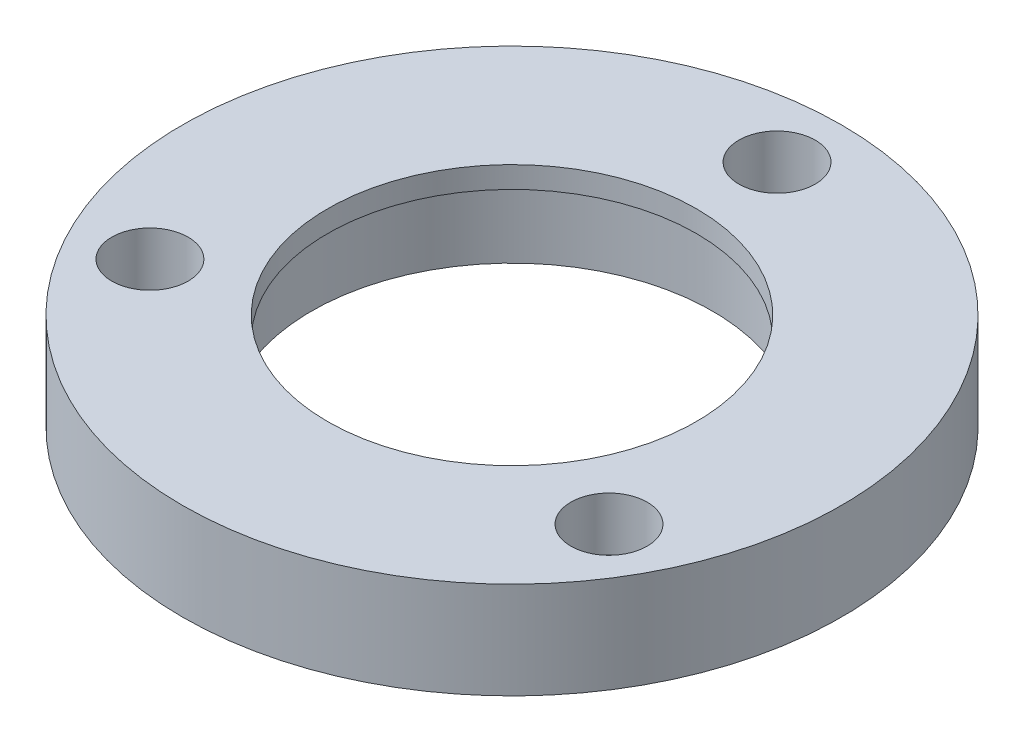
from build123d import *

# Parameters (mm, degrees)
SKETCH_2_R            = 2.25
CUT_EXTRUDE_673_DEPTH = 45.270136661
SKETCH_2_3_R          = 3.55
SKETCH_2_3_R_2        = 2.25
CUT_EXTRUDE_707_DEPTH = 5


with BuildPart() as part:
    # Sketch 278 → Повернуть1 (revolve)
    with BuildSketch(Plane.XY):
        Polygon((17.15, 9), (30.65, 9), (30.65, 0), (18.65, 0), (18.65, 7), (17.15, 7), align=None)
    revolve(axis=Axis((0, 23.662648221, 0), (0, -1, 0)))

    # Эскиз2 → Cut-Extrude 673 (cut, through all)
    with BuildSketch(Plane(origin=(0, 9, 0), x_dir=(1, 0, 0), z_dir=(0, 1, 0))):
        with Locations((0, 24.65)):
            Circle(SKETCH_2_R)
        with Locations((21.347526203, -12.325)):
            Circle(SKETCH_2_R)
        with Locations((-21.347526203, -12.325)):
            Circle(SKETCH_2_R)
    extrude(amount=-CUT_EXTRUDE_673_DEPTH, mode=Mode.SUBTRACT)

    # Эскиз2<3> → Cut-Extrude 707 (cut)
    # profile 1 of 3: a face of its own
    with BuildSketch(Plane(origin=(0, 9, 0), x_dir=(1, 0, 0), z_dir=(0, 1, 0))):
        with Locations((0, 24.65)):
            Circle(SKETCH_2_3_R)
        with Locations((0, 24.65)):
            Circle(SKETCH_2_3_R_2, mode=Mode.SUBTRACT)
    # profile 2 of 3: a face of its own
    with BuildSketch(Plane(origin=(0, 9, 0), x_dir=(1, 0, 0), z_dir=(0, 1, 0))):
        with Locations((-21.347526203, -12.325)):
            Circle(SKETCH_2_3_R)
        with Locations((-21.347526203, -12.325)):
            Circle(SKETCH_2_3_R_2, mode=Mode.SUBTRACT)
    # profile 3 of 3: a face of its own
    with BuildSketch(Plane(origin=(0, 9, 0), x_dir=(1, 0, 0), z_dir=(0, 1, 0))):
        with Locations((21.347526203, -12.325)):
            Circle(SKETCH_2_3_R)
        with Locations((21.347526203, -12.325)):
            Circle(SKETCH_2_3_R_2, mode=Mode.SUBTRACT)
    extrude(amount=-CUT_EXTRUDE_707_DEPTH, mode=Mode.SUBTRACT)


solid = part.part
